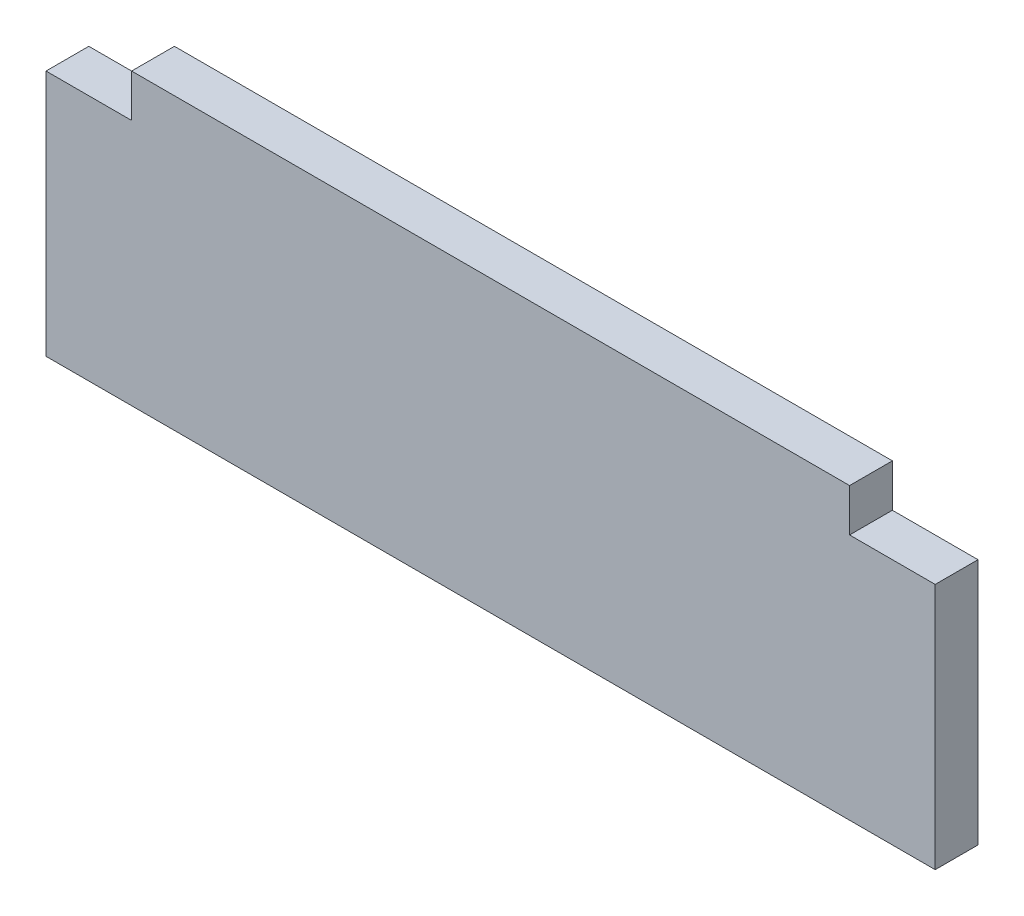
from build123d import *

# Parameters (mm, degrees)
SKETCH1_W           = 131.900000106
SKETCH1_H           = 43.000000106
BOSS_EXTRUDE1_DEPTH = 3.175
SKETCH2_W           = 12.7
SKETCH2_H           = 6.35
CUT_EXTRUDE1_DEPTH  = 70.656119683


with BuildPart() as part:
    # Sketch1 → Boss-Extrude1 (new, symmetric)
    with BuildSketch(Plane.XY):
        Rectangle(SKETCH1_W, SKETCH1_H)
    extrude(amount=BOSS_EXTRUDE1_DEPTH, both=True)

    # Sketch2 → Cut-Extrude1 (cut, through all)
    with BuildSketch(Plane.XY.offset(3.175)):
        with Locations((-59.600000053, 18.325000053)):
            Rectangle(SKETCH2_W, SKETCH2_H)
    cut_extrude1 = extrude(amount=-CUT_EXTRUDE1_DEPTH, mode=Mode.SUBTRACT)

    # Mirror1: Cut-Extrude1 across plane
    add(cut_extrude1.mirror(Plane(origin=(0, 0, 0), x_dir=(0, 0, 1), z_dir=(1, 0, 0))), mode=Mode.SUBTRACT)


solid = part.part
